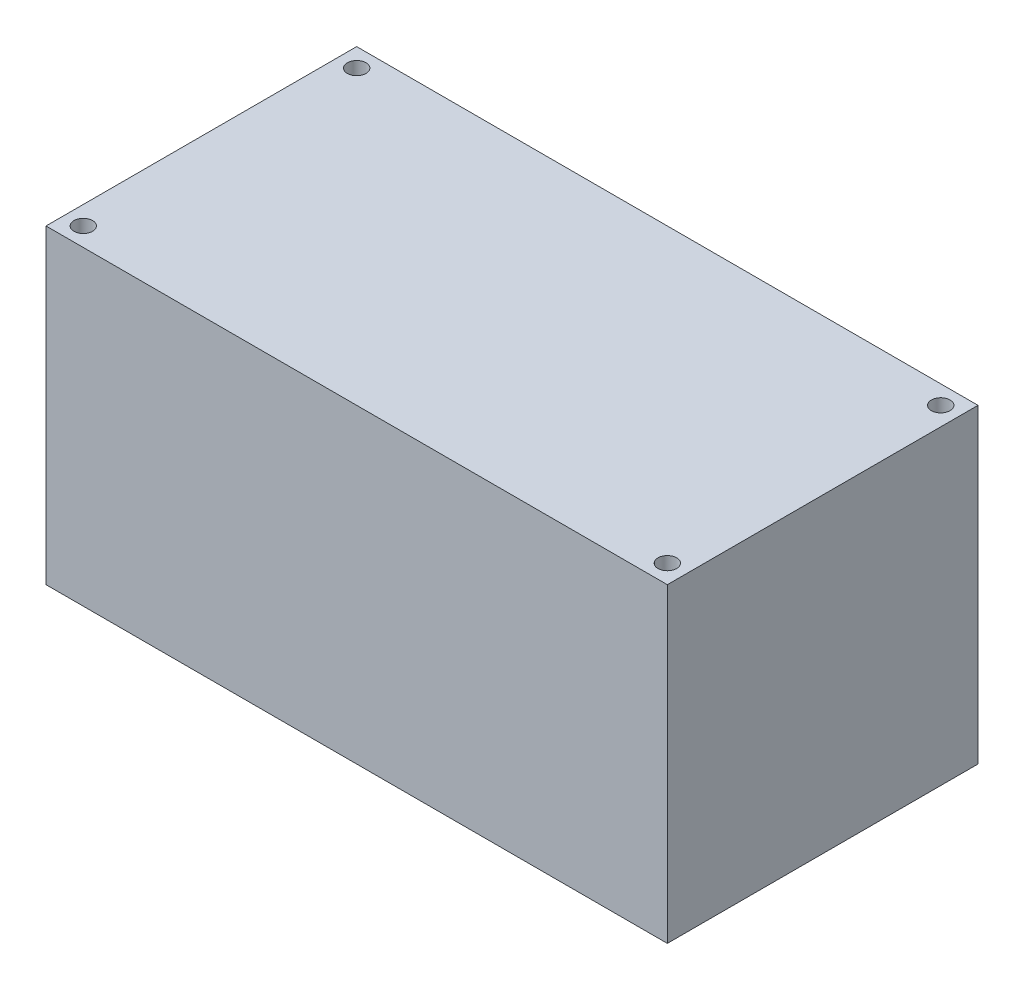
from build123d import *

# Parameters (mm, degrees)
ESQUISSE2_W             = 100
ESQUISSE2_H             = 50
BOSS_EXTRU_1_DEPTH      = 50
ESQUISSE3_R             = 1.5
ENL_V_MAT_EXTRU_1_DEPTH = 30


with BuildPart() as part:
    # Esquisse2 → Boss.-Extru.1 (new body)
    with BuildSketch(Plane(origin=(0, 0, 0), x_dir=(1, 0, 0), z_dir=(0, 1, 0))):
        Rectangle(ESQUISSE2_W, ESQUISSE2_H)
    extrude(amount=BOSS_EXTRU_1_DEPTH)

    # Esquisse3 → Enlèv. mat.-Extru.1 (cut)
    with BuildSketch(Plane(origin=(0, 50, 0), x_dir=(1, 0, 0), z_dir=(0, 1, 0))):
        with Locations(Location((-47, 22, 0), (0, 0, 270))):
            Circle(ESQUISSE3_R)
        with Locations(Location((-47, -22, 0), (0, 0, 270))):
            Circle(ESQUISSE3_R)
        with Locations(Location((47, -22, 0), (0, 0, 90))):
            Circle(ESQUISSE3_R)
        with Locations(Location((47, 22, 0), (0, 0, 90))):
            Circle(ESQUISSE3_R)
    extrude(amount=-ENL_V_MAT_EXTRU_1_DEPTH, mode=Mode.SUBTRACT)


solid = part.part
